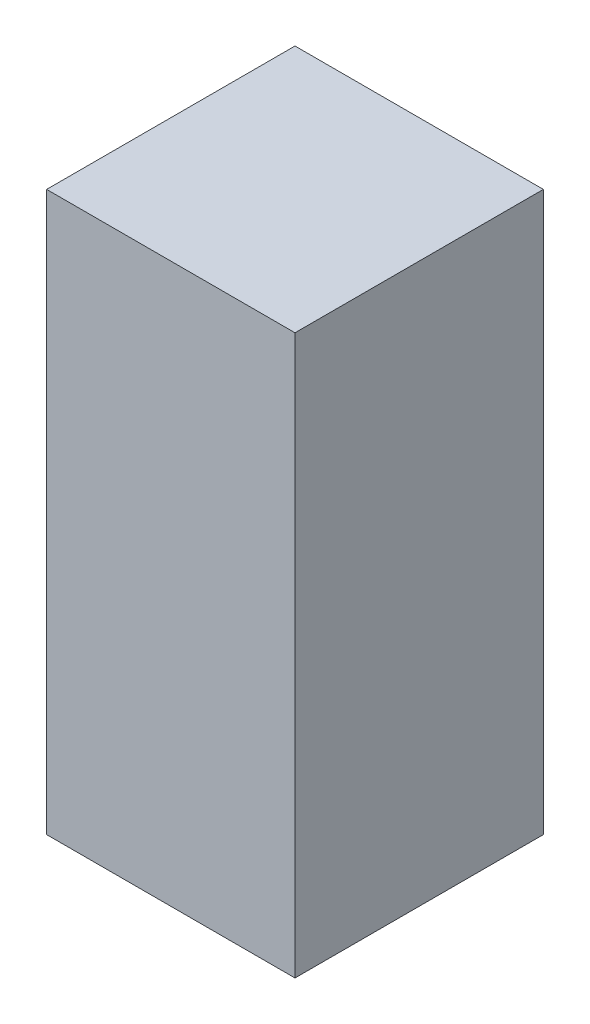
from build123d import *

# Parameters (mm, degrees)
SKETCH1_W           = 100
SKETCH1_H           = 100
BOSS_EXTRUDE1_DEPTH = 225


with BuildPart() as part:
    # Sketch1 → Boss-Extrude1 (new body)
    with BuildSketch(Plane(origin=(0, 0, 0), x_dir=(1, 0, 0), z_dir=(0, 1, 0))):
        Rectangle(SKETCH1_W, SKETCH1_H)
    extrude(amount=BOSS_EXTRUDE1_DEPTH)


solid = part.part
